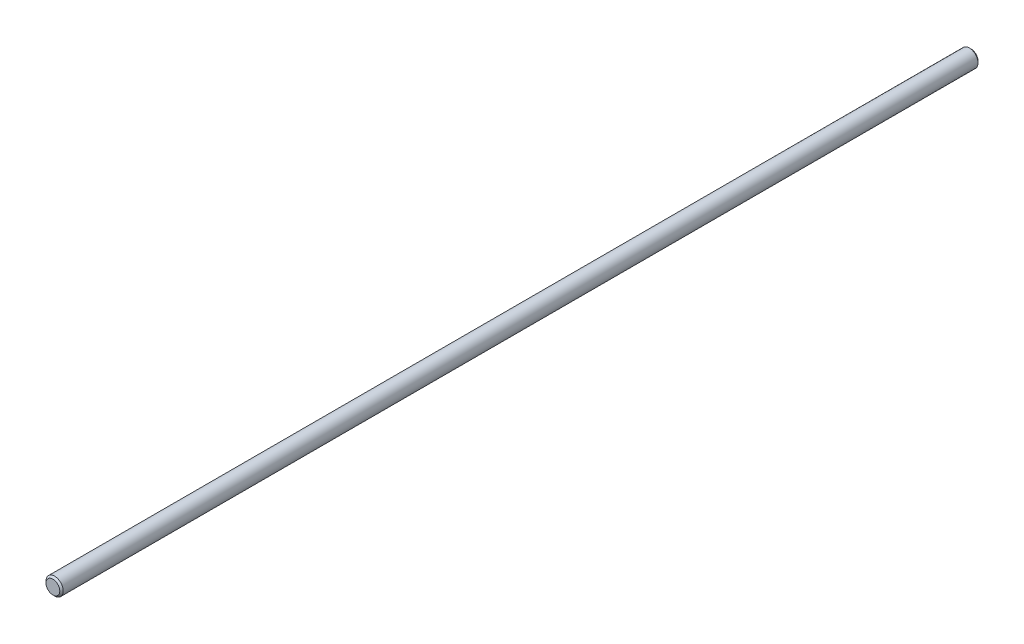
from build123d import *

# Parameters (mm, degrees)
SKETCH1_R      = 3
EXTRUDE1_DEPTH = 160
CHAMFER1_SIZE  = 0.6


with BuildPart() as part:
    # Sketch1 → Extrude1 (new, symmetric)
    with BuildSketch(Plane.XY):
        Circle(SKETCH1_R)
    extrude(amount=EXTRUDE1_DEPTH, both=True)

    # Chamfer1
    chamfer1_edges = [part.edges().sort_by_distance(p)[0] for p in [
        (-3, 0, -160),
        (-3, 0, 160),
    ]]
    chamfer(chamfer1_edges, length=CHAMFER1_SIZE)


solid = part.part
